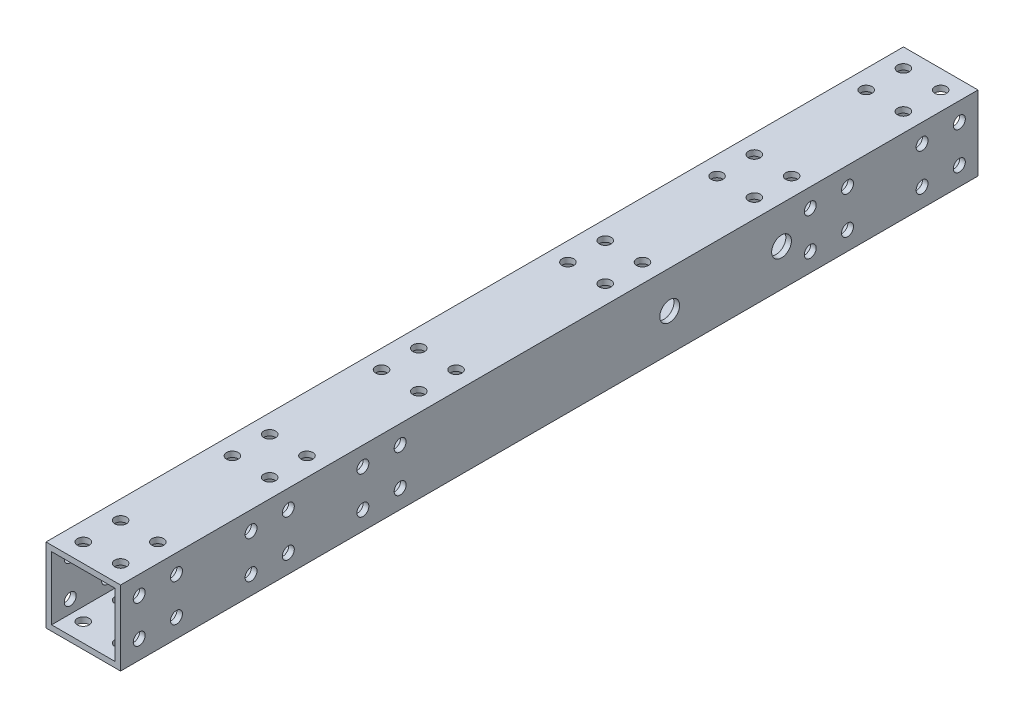
from build123d import *

# Parameters (mm, degrees)
SKETCH_1_W          = 20
SKETCH_1_H          = 20
SKETCH_1_W_2        = 17
SKETCH_1_H_2        = 17
EXTRUDE_1_DEPTH     = 230
SKETCH_2_R          = 2.65
SKETCH_2_R_2        = 1.6
CUT_EXTRUDE_1_DEPTH = 232.732604525
SKETCH_3_R          = 1.575
CUT_EXTRUDE_2_DEPTH = 232.732604525


with BuildPart() as part:
    # 草图1 → 拉伸-薄壁1 (new body)
    with BuildSketch(Plane.XY):
        with Locations((10, -10)):
            Rectangle(SKETCH_1_W, SKETCH_1_H)
        with Locations((10, -10)):
            Rectangle(SKETCH_1_W_2, SKETCH_1_H_2, mode=Mode.SUBTRACT)
    extrude(amount=EXTRUDE_1_DEPTH)

    # 草图2 → 切除-拉伸1 (cut, through all)
    with BuildSketch(Plane(origin=(20, 0, 0), x_dir=(0, 0, -1), z_dir=(1, 0, 0))):
        with Locations((-82.7, -10)):
            Circle(SKETCH_2_R)
        with Locations((-52.7, -10)):
            Circle(SKETCH_2_R)
        with Locations((-225, -5)):
            Circle(SKETCH_2_R_2)
        with Locations(Location((-225, -15, 0), (0, 0, 180))):
            Circle(SKETCH_2_R_2)
        with Locations((-215, -15)):
            Circle(SKETCH_2_R_2)
        with Locations(Location((-215, -5, 0), (0, 0, 180))):
            Circle(SKETCH_2_R_2)
        with Locations((-195, -5)):
            Circle(SKETCH_2_R_2)
        with Locations(Location((-185, -5, 0), (0, 0, 180))):
            Circle(SKETCH_2_R_2)
        with Locations((-185, -15)):
            Circle(SKETCH_2_R_2)
        with Locations(Location((-195, -15, 0), (0, 0, 180))):
            Circle(SKETCH_2_R_2)
        with Locations((-165, -5)):
            Circle(SKETCH_2_R_2)
        with Locations(Location((-155, -5, 0), (0, 0, 180))):
            Circle(SKETCH_2_R_2)
        with Locations((-155, -15)):
            Circle(SKETCH_2_R_2)
        with Locations(Location((-165, -15, 0), (0, 0, 180))):
            Circle(SKETCH_2_R_2)
        with Locations((-35, -15)):
            Circle(SKETCH_2_R_2)
        with Locations(Location((-45, -15, 0), (0, 0, 180))):
            Circle(SKETCH_2_R_2)
        with Locations((-45, -5)):
            Circle(SKETCH_2_R_2)
        with Locations(Location((-35, -5, 0), (0, 0, 180))):
            Circle(SKETCH_2_R_2)
        with Locations((-15, -5)):
            Circle(SKETCH_2_R_2)
        with Locations(Location((-15, -15, 0), (0, 0, 180))):
            Circle(SKETCH_2_R_2)
        with Locations((-5, -15)):
            Circle(SKETCH_2_R_2)
        with Locations(Location((-5, -5, 0), (0, 0, 180))):
            Circle(SKETCH_2_R_2)
    extrude(amount=-CUT_EXTRUDE_1_DEPTH, mode=Mode.SUBTRACT)

    # 草图3 → 切除-拉伸2 (cut, through all)
    with BuildSketch(Plane(origin=(0, 0, 0), x_dir=(1, 0, 0), z_dir=(0, 1, 0))):
        with Locations(Location((5, -5, 0), (0, 0, 270))):
            Circle(SKETCH_3_R)
        with Locations(Location((15, -5, 0), (0, 0, 90))):
            Circle(SKETCH_3_R)
        with Locations(Location((15, -15, 0), (0, 0, 270))):
            Circle(SKETCH_3_R)
        with Locations(Location((5, -15, 0), (0, 0, 90))):
            Circle(SKETCH_3_R)
        with Locations(Location((5, -215, 0), (0, 0, 270))):
            Circle(SKETCH_3_R)
        with Locations(Location((15, -215, 0), (0, 0, 90))):
            Circle(SKETCH_3_R)
        with Locations(Location((15, -225, 0), (0, 0, 270))):
            Circle(SKETCH_3_R)
        with Locations(Location((5, -225, 0), (0, 0, 90))):
            Circle(SKETCH_3_R)
        with Locations(Location((5, -45, 0), (0, 0, 270))):
            Circle(SKETCH_3_R)
        with Locations(Location((15, -45, 0), (0, 0, 90))):
            Circle(SKETCH_3_R)
        with Locations(Location((15, -55, 0), (0, 0, 270))):
            Circle(SKETCH_3_R)
        with Locations(Location((5, -55, 0), (0, 0, 90))):
            Circle(SKETCH_3_R)
        with Locations(Location((5, -85, 0), (0, 0, 270))):
            Circle(SKETCH_3_R)
        with Locations(Location((15, -85, 0), (0, 0, 90))):
            Circle(SKETCH_3_R)
        with Locations(Location((15, -95, 0), (0, 0, 270))):
            Circle(SKETCH_3_R)
        with Locations(Location((5, -95, 0), (0, 0, 90))):
            Circle(SKETCH_3_R)
        with Locations(Location((5, -135, 0), (0, 0, 270))):
            Circle(SKETCH_3_R)
        with Locations(Location((15, -135, 0), (0, 0, 90))):
            Circle(SKETCH_3_R)
        with Locations(Location((15, -145, 0), (0, 0, 270))):
            Circle(SKETCH_3_R)
        with Locations(Location((5, -145, 0), (0, 0, 90))):
            Circle(SKETCH_3_R)
        with Locations(Location((5, -175, 0), (0, 0, 270))):
            Circle(SKETCH_3_R)
        with Locations(Location((15, -175, 0), (0, 0, 90))):
            Circle(SKETCH_3_R)
        with Locations(Location((15, -185, 0), (0, 0, 270))):
            Circle(SKETCH_3_R)
        with Locations(Location((5, -185, 0), (0, 0, 90))):
            Circle(SKETCH_3_R)
    extrude(amount=-CUT_EXTRUDE_2_DEPTH, mode=Mode.SUBTRACT)


solid = part.part
